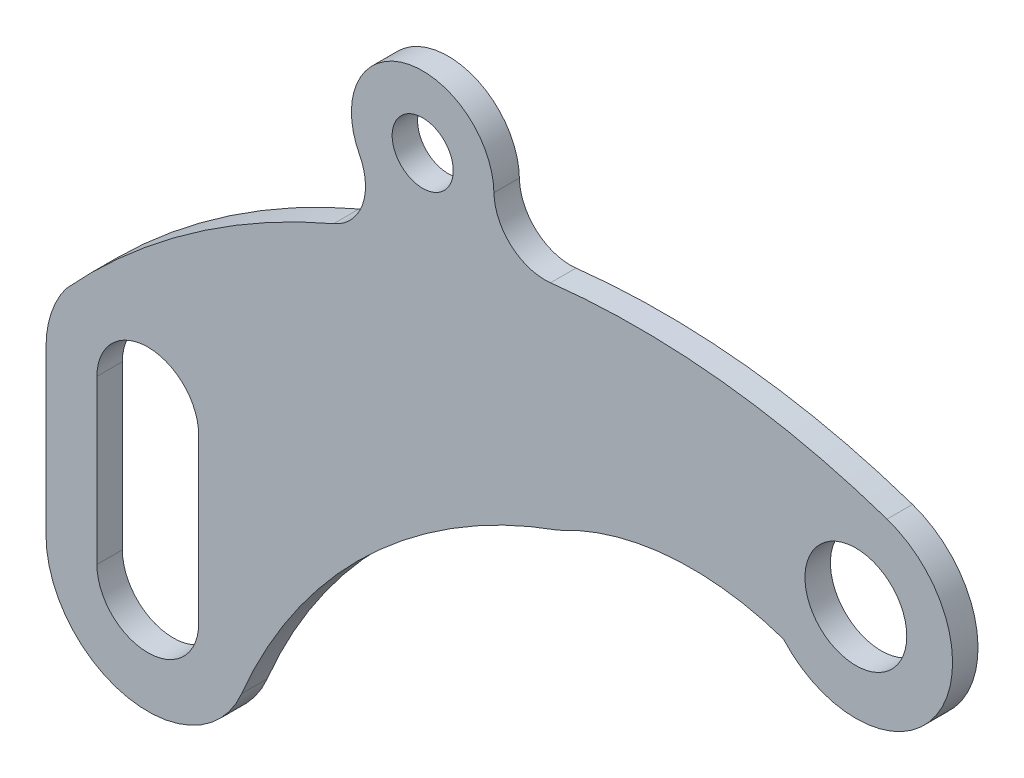
from build123d import *

# Parameters (mm, degrees)
SKETCH1_R           = 6
SKETCH1_R_2         = 10
BOSS_EXTRUDE5_DEPTH = 5


with BuildPart() as part:
    # Sketch1 → Boss-Extrude5 (new body)
    with BuildSketch(Plane.XY):
        with BuildLine():
            ThreePointArc((-70.058465936, -58.078352807), (-72.989066837, -63.721836205), (-74, -70))
            Line((-74, -70), (-74, -102))
            ThreePointArc((-74, -102), (-57.94255977, -121.607555239), (-35.554377754, -109.730395847))
            ThreePointArc((-35.554377754, -109.730395847), (-10.665501502, -73.723982253), (26.649375188, -50.843467428))
            ThreePointArc((26.649375188, -50.843467428), (48.384433069, -44.417618227), (70.872883052, -47.241427079))
            ThreePointArc((70.872883052, -47.241427079), (100.915737424, -45.173387051), (91.224909648, -16.661323894))
            ThreePointArc((91.224909648, -16.661323894), (58.568789172, -9.425322294), (25.12069127, -9.506995785))
            ThreePointArc((25.12069127, -9.506995785), (17.4015399, -7.087809111), (13.997757222, 0.250584822))
            ThreePointArc((13.997757222, 0.250584822), (-3.45943961, 13.565849682), (-12.408356532, -6.483262156))
            ThreePointArc((-12.408356532, -6.483262156), (-11.834915893, -14.73854087), (-17.505199272, -20.765675115))
            ThreePointArc((-17.505199272, -20.765675115), (-45.782270653, -36.604484887), (-70.058465936, -58.078352807))
        make_face()
        with BuildLine():
            ThreePointArc((-44, -102), (-54, -112), (-64, -102))
            Line((-64, -102), (-64, -70))
            ThreePointArc((-64, -70), (-54, -60), (-44, -70))
            Line((-44, -70), (-44, -102))
        make_face(mode=Mode.SUBTRACT)
        Circle(SKETCH1_R, mode=Mode.SUBTRACT)
        with Locations((85.098500813, -34.646515436)):
            Circle(SKETCH1_R_2, mode=Mode.SUBTRACT)
    extrude(amount=BOSS_EXTRUDE5_DEPTH)


solid = part.part
